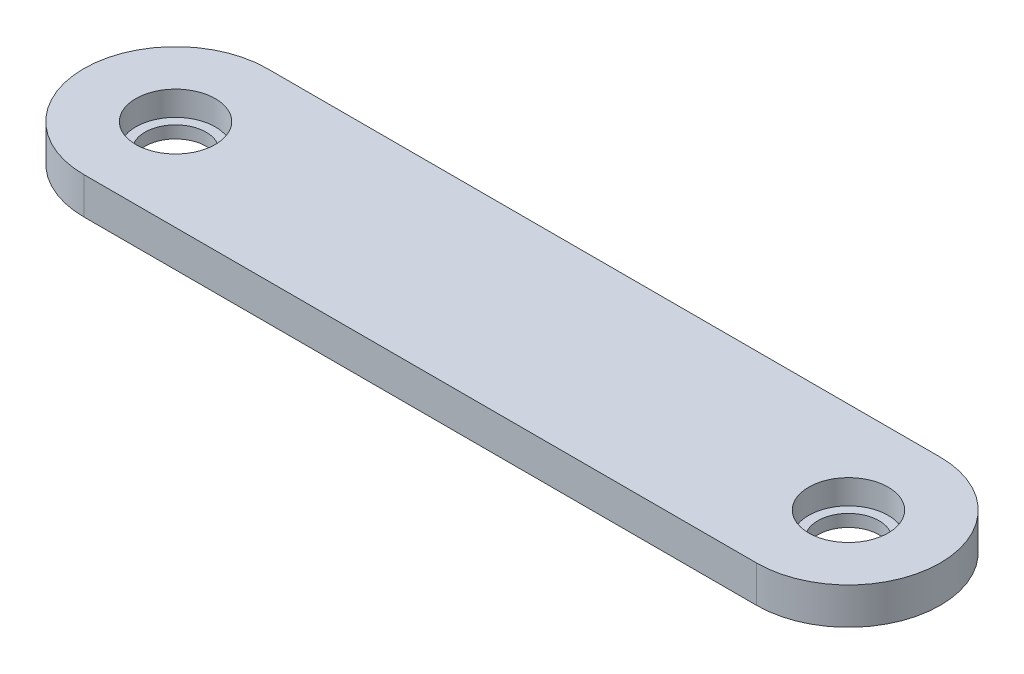
from build123d import *

# Parameters (mm, degrees)
SKETCH2_R           = 5
BOSS_EXTRUDE1_DEPTH = 6
SKETCH3_R           = 6.5
CUT_EXTRUDE1_DEPTH  = 4


with BuildPart() as part:
    # Sketch2 → Boss-Extrude1 (new body)
    with BuildSketch(Plane(origin=(0, 0, 0), x_dir=(1, 0, 0), z_dir=(0, 1, 0))):
        with BuildLine():
            Line((-45, 15), (65, 15))
            ThreePointArc((65, 15), (80, 0), (65, -15))
            Line((65, -15), (-45, -15))
            ThreePointArc((-45, -15), (-60, 0), (-45, 15))
        make_face()
        with Locations(Location((-45, 0, 0), (0, 0, 270))):
            Circle(SKETCH2_R, mode=Mode.SUBTRACT)
        with Locations(Location((65, 0, 0), (0, 0, 270))):
            Circle(SKETCH2_R, mode=Mode.SUBTRACT)
    extrude(amount=BOSS_EXTRUDE1_DEPTH)

    # Sketch3 → Cut-Extrude1 (cut)
    with BuildSketch(Plane(origin=(0, 6, 0), x_dir=(1, 0, 0), z_dir=(0, 1, 0))):
        with Locations(Location((-45, 0, 0), (0, 0, 270))):
            Circle(SKETCH3_R)
        with Locations(Location((65, 0, 0), (0, 0, 270))):
            Circle(SKETCH3_R)
    extrude(amount=-CUT_EXTRUDE1_DEPTH, mode=Mode.SUBTRACT)


solid = part.part
